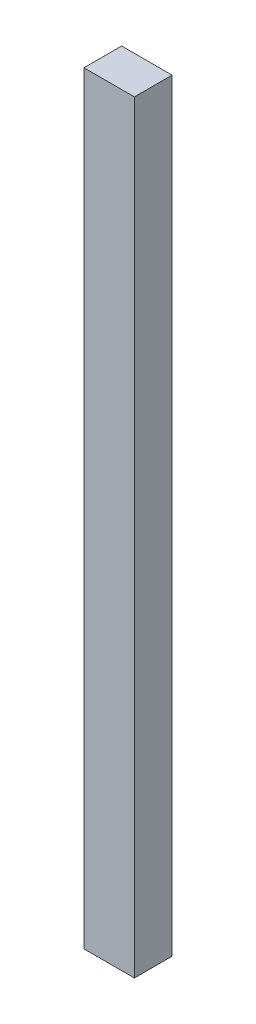
from build123d import *

# Parameters (mm, degrees)
SKETCH1_W           = 58.800188212
SKETCH1_H           = 43.904140532
BOSS_EXTRUDE1_DEPTH = 889


with BuildPart() as part:
    # Sketch1 → Boss-Extrude1 (new body)
    with BuildSketch(Plane(origin=(0, 0, 0), x_dir=(1, 0, 0), z_dir=(0, 1, 0))):
        with Locations((1.568005019, -2.548008156)):
            Rectangle(SKETCH1_W, SKETCH1_H)
    extrude(amount=BOSS_EXTRUDE1_DEPTH)


solid = part.part
